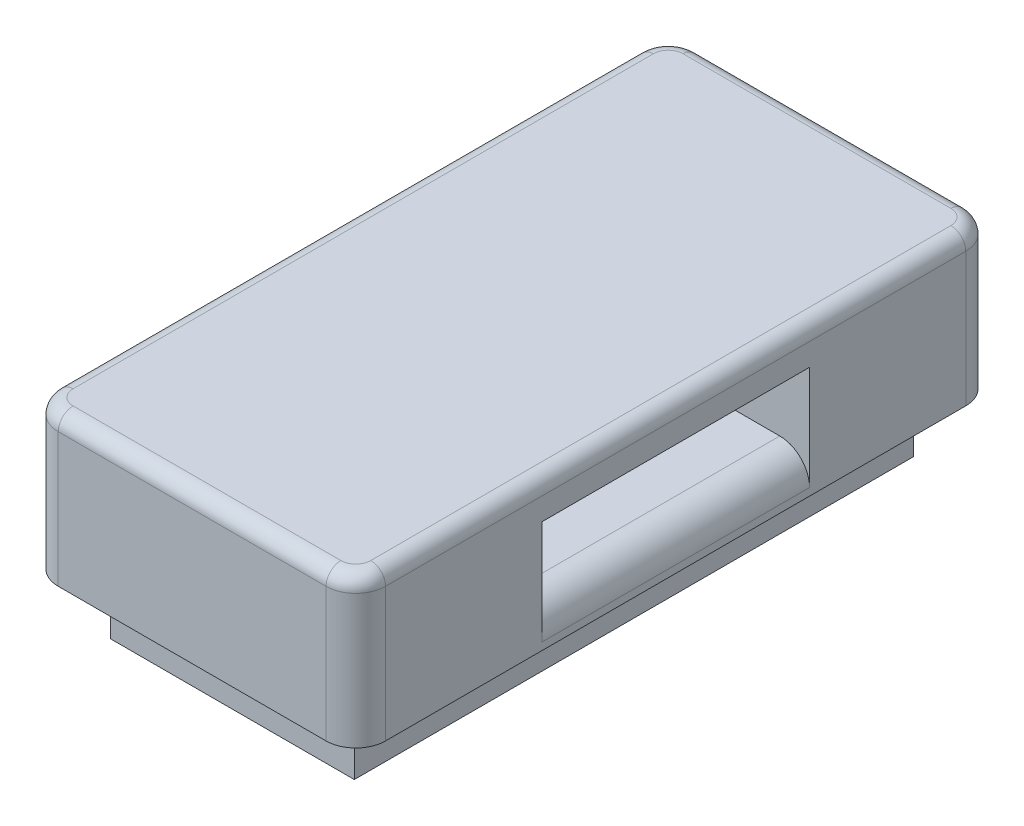
from build123d import *

# Parameters (mm, degrees)
BOSS_EXTRUDE1_DEPTH = 10
SKETCH1_4_W         = 16.4
SKETCH1_4_H         = 37.6
BOSS_EXTRUDE2_DEPTH = 4
SKETCH3_W           = 18
SKETCH3_H           = 5
CUT_EXTRUDE2_DEPTH  = 41.099875312
FILLET1_R           = 2
FILLET2_R           = 1


with BuildPart() as part:
    # Sketch1 → Boss-Extrude1 (new body)
    with BuildSketch(Plane(origin=(0, 0, 0), x_dir=(1, 0, 0), z_dir=(0, 1, 0))):
        with BuildLine():
            Line((-9, -21.5), (9, -21.5))
            ThreePointArc((9, -21.5), (10.414213562, -20.914213562), (11, -19.5))
            Line((11, -19.5), (11, 19.5))
            ThreePointArc((11, 19.5), (10.414213562, 20.914213562), (9, 21.5))
            Line((9, 21.5), (-9, 21.5))
            ThreePointArc((-9, 21.5), (-10.414213562, 20.914213562), (-11, 19.5))
            Line((-11, 19.5), (-11, -19.5))
            ThreePointArc((-11, -19.5), (-10.414213562, -20.914213562), (-9, -21.5))
        make_face()
    extrude(amount=BOSS_EXTRUDE1_DEPTH)

    # Sketch1<4> → Boss-Extrude2 (add)
    with BuildSketch(Plane(origin=(0, 0, 0), x_dir=(1, 0, 0), z_dir=(0, 1, 0))):
        Rectangle(SKETCH1_4_W, SKETCH1_4_H)
    extrude(amount=-BOSS_EXTRUDE2_DEPTH)

    # Sketch3 → Cut-Extrude2 (cut, through all)
    with BuildSketch(Plane(origin=(-11, 0, 10.5), x_dir=(0, 0, -1), z_dir=(1, 0, 0))):
        with Locations((10.5, 5)):
            Rectangle(SKETCH3_W, SKETCH3_H)
    extrude(amount=CUT_EXTRUDE2_DEPTH, mode=Mode.SUBTRACT)

    # Fillet1
    fillet1_edges = [part.edges().sort_by_distance(p)[0] for p in [
        (11, 2.5, 0),
        (-11, 2.5, 0),
    ]]
    fillet(fillet1_edges, radius=FILLET1_R)

    # Fillet2
    fillet2_edges = [part.edges().sort_by_distance(p)[0] for p in [
        (-10.414213562, 10, 20.914213562),
        (-11, 10, 0),
        (-10.414213562, 10, -20.914213562),
        (0, 10, -21.5),
        (10.414213562, 10, -20.914213562),
        (11, 10, 0),
        (10.414213562, 10, 20.914213562),
        (0, 10, 21.5),
    ]]
    fillet(fillet2_edges, radius=FILLET2_R)


solid = part.part
